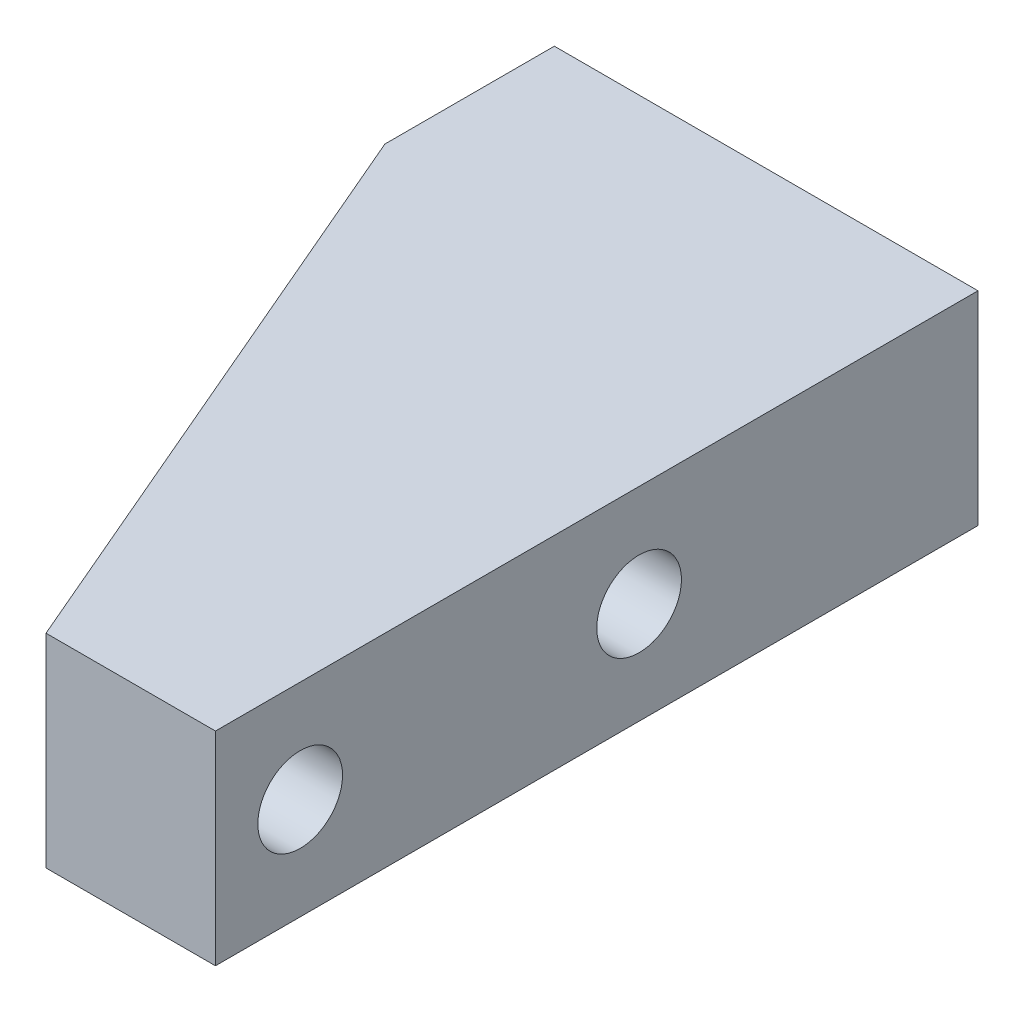
from build123d import *

# Parameters (mm, degrees)
EXTRUDE_1_DEPTH        = 6
HOLE_WIZARD_M6_2_D     = 5
HOLE_WIZARD_M6_2_DEPTH = 15
HOLE_WIZARD_M6_2_TIP   = 1.502151548
HOLE_WIZARD_M6_1_D     = 5
HOLE_WIZARD_M6_1_DEPTH = 15
HOLE_WIZARD_M6_1_TIP   = 1.502151548


with BuildPart() as part:
    # 草图1 → 凸台-拉伸1 (new, symmetric)
    with BuildSketch(Plane(origin=(0, 0, 0), x_dir=(1, 0, 0), z_dir=(0, 1, 0))):
        Polygon((0, 0), (25, 0), (25, -45), (15, -45), (0, -10), align=None)
    extrude(amount=EXTRUDE_1_DEPTH, both=True)

    # M6 螺纹孔2
    with Locations(Plane(origin=(25, 0, 0), x_dir=(0, 0, -1), z_dir=(1, 0, 0))):
        with Locations((-20, 0), (-40, 0)):
            Hole(HOLE_WIZARD_M6_2_D / 2, depth=HOLE_WIZARD_M6_2_DEPTH)
            with Locations((0, 0, -(HOLE_WIZARD_M6_2_DEPTH + HOLE_WIZARD_M6_2_TIP / 2))):  # 118° drill point
                Cone(0, HOLE_WIZARD_M6_2_D / 2, HOLE_WIZARD_M6_2_TIP, mode=Mode.SUBTRACT)

    # M6 螺纹孔1
    with Locations(Plane(origin=(0, 0, 0), x_dir=(-1, 0, 0), z_dir=(0, 0, -1))):
        with Locations((-6, 0)):
            Hole(HOLE_WIZARD_M6_1_D / 2, depth=HOLE_WIZARD_M6_1_DEPTH)
            with Locations((0, 0, -(HOLE_WIZARD_M6_1_DEPTH + HOLE_WIZARD_M6_1_TIP / 2))):  # 118° drill point
                Cone(0, HOLE_WIZARD_M6_1_D / 2, HOLE_WIZARD_M6_1_TIP, mode=Mode.SUBTRACT)


solid = part.part
